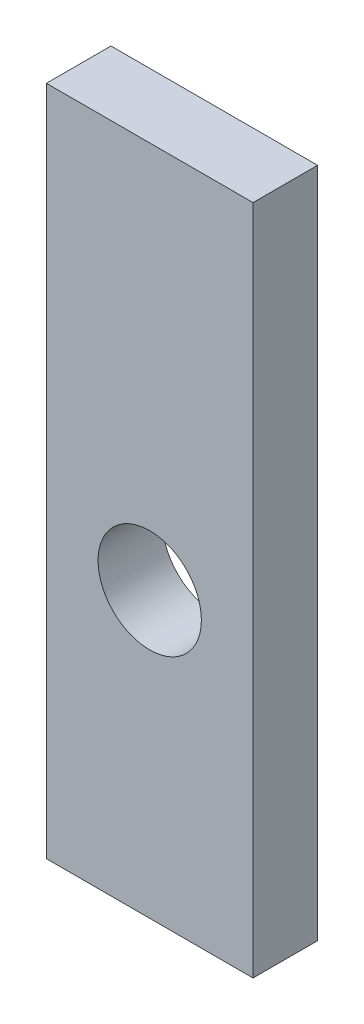
from build123d import *

# Parameters (mm, degrees)
ESBO_O1_W       = 16
ESBO_O1_H       = 52
ESBO_O1_R       = 4
EXTRUS_O1_DEPTH = 2.5


with BuildPart() as part:
    # Esboço1 → Extrusão1 (new, symmetric)
    with BuildSketch(Plane.XY):
        with Locations((0, 4)):
            Rectangle(ESBO_O1_W, ESBO_O1_H)
        Circle(ESBO_O1_R, mode=Mode.SUBTRACT)
    extrude(amount=EXTRUS_O1_DEPTH, both=True)


solid = part.part
